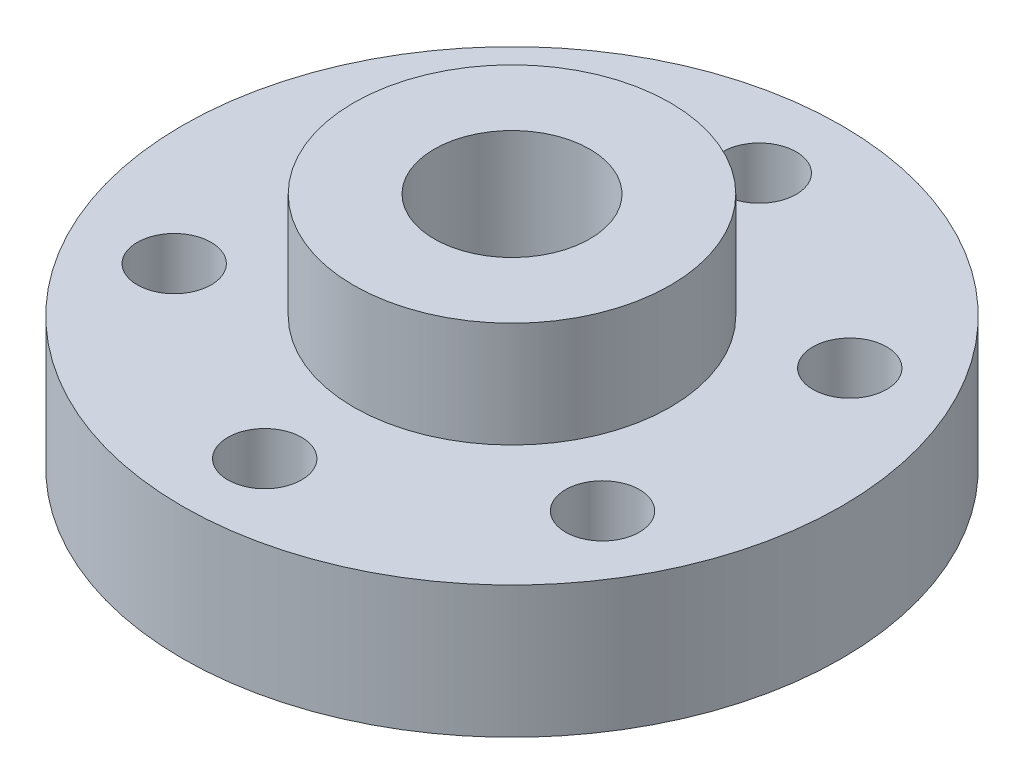
from build123d import *

# Parameters (mm, degrees)
SKETCH2_R          = 1.4224
CUT_EXTRUDE1_DEPTH = 21.154223776
CIRPATTERN1_COUNT  = 6


with BuildPart() as part:
    # Sketch1 → Revolve1 (revolve)
    with BuildSketch(Plane.XY, mode=Mode.PRIVATE) as revolve1_sk:
        Polygon((2.9972, 0), (12.7, 0), (12.7, 5.08), (6.096, 5.08), (6.096, 9.144), (2.9972, 9.144), align=None)
    revolve(revolve1_sk.sketch.rotate(Axis((0, 0, 0), (0, 1, 0)), 90), axis=Axis((0, 0, 0), (0, 1, 0)))

    # Sketch2 → Cut-Extrude1 (cut, through all)
    with BuildSketch(Plane(origin=(0, 0, 0), x_dir=(1, 0, 0), z_dir=(0, 1, 0))):
        with Locations(Location((0, 9.525, 0), (0, 0, 270))):
            Circle(SKETCH2_R)
    cut_extrude1 = extrude(amount=CUT_EXTRUDE1_DEPTH, mode=Mode.SUBTRACT)

    # CirPattern1: Cut-Extrude1 ×6 about axis
    cirpattern1_axis = Axis((0, 0, 0), (0, 1, 0))
    for i in range(1, CIRPATTERN1_COUNT):
        add(cut_extrude1.rotate(cirpattern1_axis, i * 360 / CIRPATTERN1_COUNT), mode=Mode.SUBTRACT)


solid = part.part
